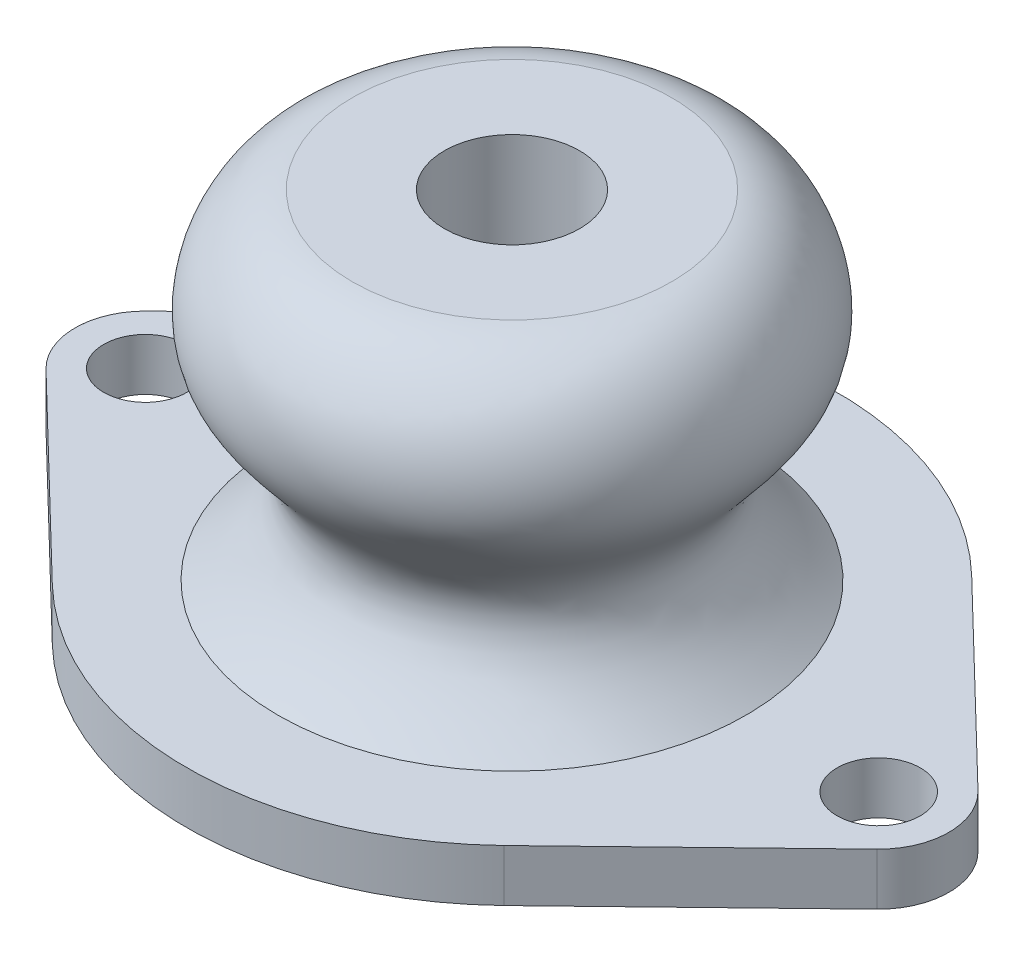
from build123d import *

# Parameters (mm, degrees)
SKETCH1_R           = 2.032
SKETCH1_R_2         = 3.302
BOSS_EXTRUDE1_DEPTH = 2.54


with BuildPart() as part:
    # Sketch1 → Boss-Extrude1 (new body)
    with BuildSketch(Plane(origin=(0, 0, 0), x_dir=(1, 0, 0), z_dir=(0, 1, 0))):
        with BuildLine():
            Line((-20.290276596, 2.465366843), (-11.033687943, 11.413735382))
            ThreePointArc((-11.033687943, 11.413735382), (0, 15.875), (11.033687943, 11.413735382))
            Line((11.033687943, 11.413735382), (20.290276596, 2.465366843))
            ThreePointArc((20.290276596, 2.465366843), (21.336, 0), (20.290276596, -2.465366843))
            Line((20.290276596, -2.465366843), (11.033687943, -11.413735382))
            ThreePointArc((11.033687943, -11.413735382), (0, -15.875), (-11.033687943, -11.413735382))
            Line((-11.033687943, -11.413735382), (-20.290276596, -2.465366843))
            ThreePointArc((-20.290276596, -2.465366843), (-21.336, 0), (-20.290276596, 2.465366843))
        make_face()
        with Locations(Location((-17.907, 0, 0), (0, 0, 270))):
            Circle(SKETCH1_R, mode=Mode.SUBTRACT)
        with Locations(Location((17.907, 0, 0), (0, 0, 270))):
            Circle(SKETCH1_R, mode=Mode.SUBTRACT)
        with Locations(Location((0, 0, 0), (0, 0, 270))):
            Circle(SKETCH1_R_2, mode=Mode.SUBTRACT)
    extrude(amount=BOSS_EXTRUDE1_DEPTH)

    # Sketch3 → Revolve1 (revolve)
    with BuildSketch(Plane(origin=(0, 0, 0), x_dir=(0, 0, -1), z_dir=(1, 0, 0))):
        with BuildLine():
            Line((-3.302, 19.05), (-7.794998012, 19.05))
            add(Edge.make_bspline(
                [(-7.794998012, 19.05), (-10.740596789, 18.645101439), (-14.519445993, 10.395857778), (-5.018498512, 7.761963643), (-11.43, 2.54)],
                knots=[0, 0, 0, 0, 0.449937677, 1, 1, 1, 1], degree=3))
            Line((-11.43, 2.54), (-7.62, 2.54))
            Line((-7.62, 2.54), (-7.62, 12.7))
            Line((-7.62, 12.7), (-3.302, 12.7))
            Line((-3.302, 12.7), (-3.302, 19.05))
        make_face()
    revolve(axis=Axis((0, 19.05, 0), (0, -1, 0)))


solid = part.part
